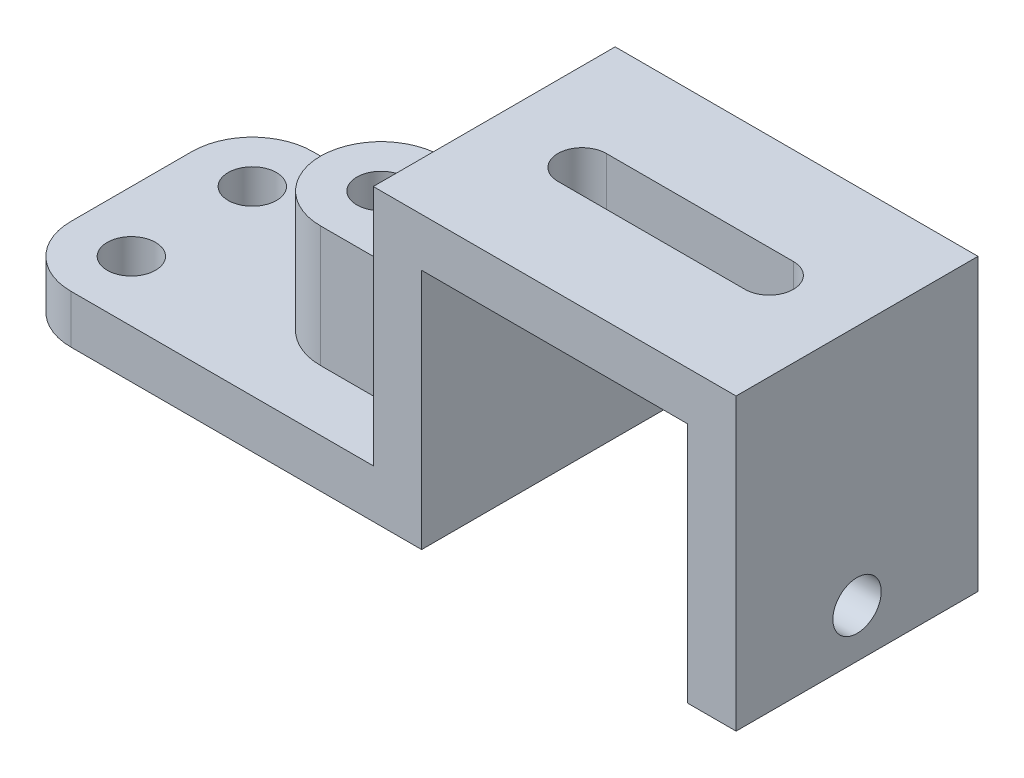
from build123d import *

# Parameters (mm, degrees)
BOSS_EXTRUDE1_DEPTH = 45
FILLET1_R           = 22.5
SKETCH2_R           = 9
CUT_EXTRUDE1_DEPTH  = 90
SKETCH3_R           = 9
BOSS_EXTRUDE2_DEPTH = 45
SKETCH4_R           = 9
CUT_EXTRUDE2_DEPTH  = 217.795410468
CUT_EXTRUDE3_DEPTH  = 45
SKETCH6_R           = 9
CUT_EXTRUDE4_DEPTH  = 45


with BuildPart() as part:
    # Sketch1 → Boss-Extrude1 (new, symmetric)
    with BuildSketch(Plane.XY):
        Polygon((-67.5, 108), (67.5, 108), (67.5, 0), (49.5, 0), (49.5, 90), (-49.5, 90), (-49.5, 0), (-67.5, 0), (-202.5, 0), (-202.5, 18), (-67.5, 18), align=None)
    extrude(amount=BOSS_EXTRUDE1_DEPTH, both=True)

    # Fillet1
    fillet1_edges = [part.edges().sort_by_distance(p)[0] for p in [
        (-202.5, 9, -45),
        (-202.5, 9, 45),
    ]]
    fillet(fillet1_edges, radius=FILLET1_R)

    # Sketch2 → Cut-Extrude1 (cut)
    with BuildSketch(Plane(origin=(0, 18, 0), x_dir=(1, 0, 0), z_dir=(0, 1, 0))):
        with Locations(Location((-180, -22.5, 0), (0, 0, 270))):
            Circle(SKETCH2_R)
        with Locations(Location((-180, 22.5, 0), (0, 0, 270))):
            Circle(SKETCH2_R)
    extrude(amount=-CUT_EXTRUDE1_DEPTH, mode=Mode.SUBTRACT)

    # Sketch3 → Boss-Extrude2 (add)
    with BuildSketch(Plane(origin=(0, 18, 0), x_dir=(1, 0, 0), z_dir=(0, 1, 0))):
        with BuildLine():
            Line((-67.5, 22.5), (-109.596739016, 22.5))
            ThreePointArc((-109.596739016, 22.5), (-132.096739016, 0), (-109.596739016, -22.5))
            Line((-109.596739016, -22.5), (-67.5, -22.5))
            Line((-67.5, -22.5), (-67.5, 22.5))
        make_face()
        with Locations(Location((-109.596739016, 0, 0), (0, 0, 90))):
            Circle(SKETCH3_R, mode=Mode.SUBTRACT)
    extrude(amount=BOSS_EXTRUDE2_DEPTH)

    # Sketch4 → Cut-Extrude2 (cut, through all)
    with BuildSketch(Plane(origin=(0, 63, 0), x_dir=(1, 0, 0), z_dir=(0, 1, 0))):
        with Locations(Location((-109.596739016, 0, 0), (0, 0, 90))):
            Circle(SKETCH4_R)
    extrude(amount=-CUT_EXTRUDE2_DEPTH, mode=Mode.SUBTRACT)

    # Sketch5 → Cut-Extrude3 (cut)
    with BuildSketch(Plane(origin=(0, 108, 0), x_dir=(1, 0, 0), z_dir=(0, 1, 0))):
        with BuildLine():
            Line((-34.803236343, 9), (34.803236343, 9))
            ThreePointArc((34.803236343, 9), (43.803236343, 0), (34.803236343, -9))
            Line((34.803236343, -9), (-34.803236343, -9))
            ThreePointArc((-34.803236343, -9), (-43.803236343, 0), (-34.803236343, 9))
        make_face()
    extrude(amount=-CUT_EXTRUDE3_DEPTH, mode=Mode.SUBTRACT)

    # Sketch6 → Cut-Extrude4 (cut)
    with BuildSketch(Plane(origin=(67.5, 0, 0), x_dir=(0, 0, -1), z_dir=(1, 0, 0))):
        with Locations((0, 18)):
            Circle(SKETCH6_R)
    extrude(amount=-CUT_EXTRUDE4_DEPTH, mode=Mode.SUBTRACT)


solid = part.part
